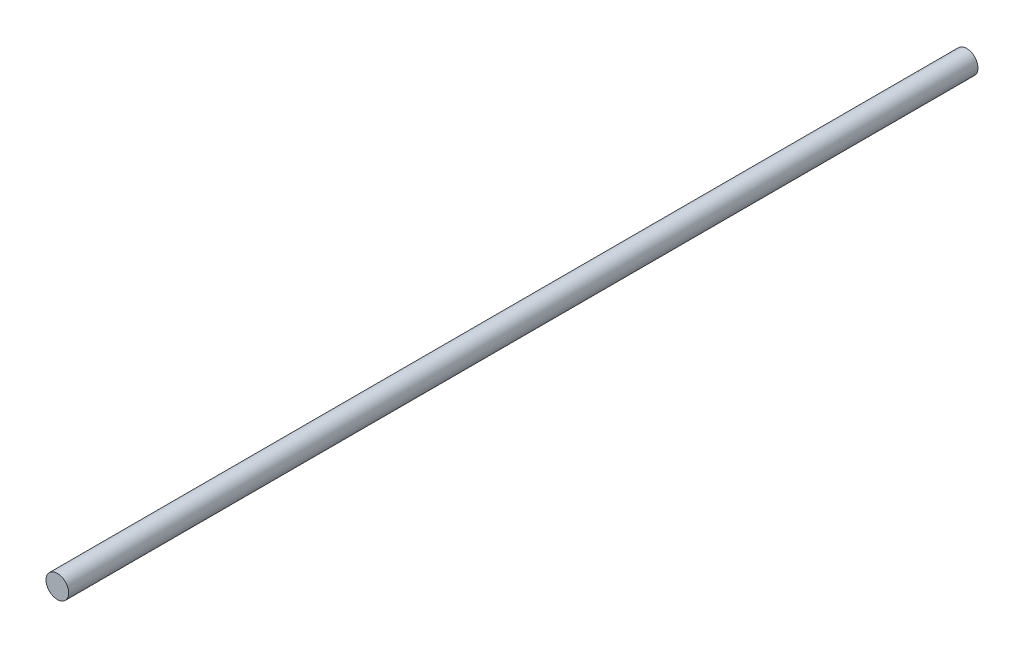
from build123d import *

# Parameters (mm, degrees)
SKETCH1_R           = 50
BOSS_EXTRUDE1_DEPTH = 4000


with BuildPart() as part:
    # Sketch1 → Boss-Extrude1 (new body)
    with BuildSketch(Plane.XY):
        Circle(SKETCH1_R)
    extrude(amount=BOSS_EXTRUDE1_DEPTH)


solid = part.part
